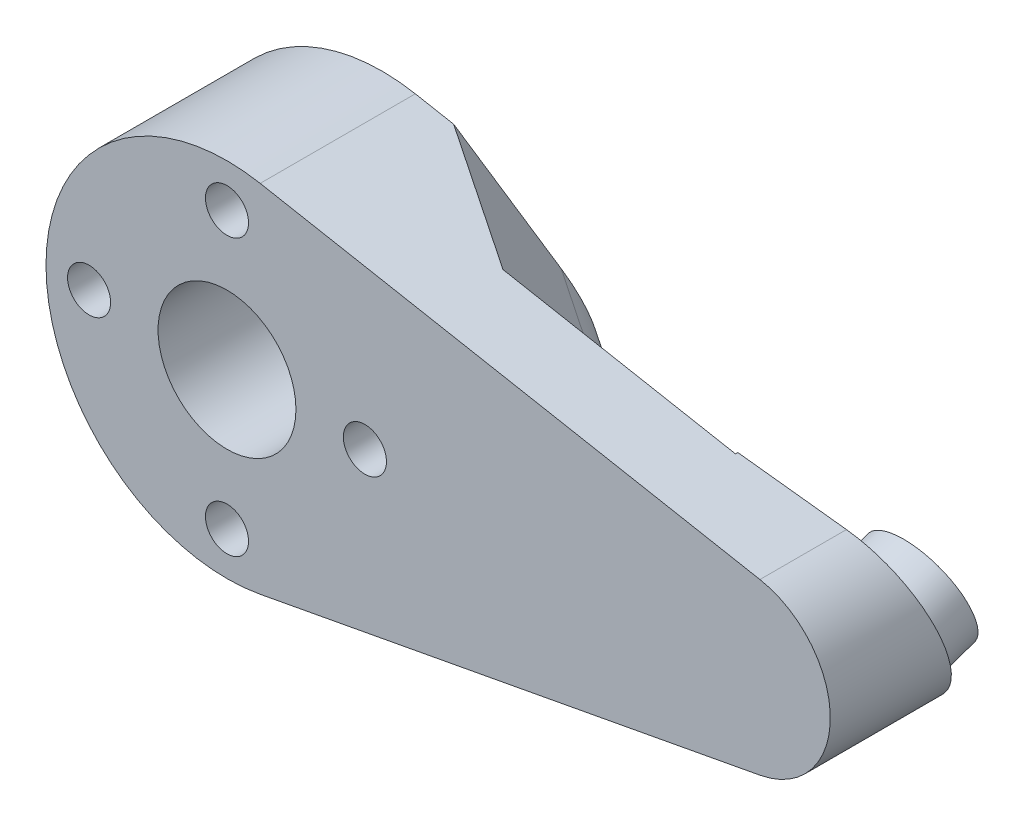
from build123d import *
from OCP.BRepFilletAPI import BRepFilletAPI_MakeChamfer

# Parameters (mm, degrees)
BOSS_EXTRU_1_DEPTH                  = 10
ENL_V_MAT_EXTRU_1_REACH             = 39.885
ESQUISSE2_R                         = 4
ESQUISSE2_R_2                       = 1.25
ENL_V_MAT_EXTRU_2_REACH             = 39.885
ENL_V_MAT_EXTRU_2_DIRECTION_2_REACH = 39.885
BOSS_EXTRU_2_START                  = 2
BOSS_EXTRU_2_DEPTH                  = 2
ENL_V_MAT_EXTRU_3_REACH             = 40.347
ESQUISSE7_R                         = 1.25
ENL_V_MAT_EXTRU_4_DEPTH             = 6
ESQUISSE8_W                         = 13.848155074
ESQUISSE8_H                         = 21.741024256
ENL_V_MAT_EXTRU_5_DEPTH             = 3
BOSS_EXTRU_3_START                  = 3
ESQUISSE9_R                         = 3.118724251
ESQUISSE9_R_2                       = 1.25
BOSS_EXTRU_3_DEPTH                  = 3
CHANFREIN1_SIZE                     = 4
CHANFREIN1_SIZE2                    = 4.445329843
CONG_1_R                            = 4
ESQUISSE10_R                        = 15.631768201
ENL_V_MAT_EXTRU_6_DEPTH             = 1


with BuildPart() as part:
    # Esquisse1 → Boss.-Extru.1 (new body)
    with BuildSketch(Plane.XY):
        with BuildLine():
            Line((1.925, 10.322033472), (30.916666667, 4.915254034))
            ThreePointArc((30.916666667, 4.915254034), (35, 0), (30.916666667, -4.915254034))
            Line((30.916666667, -4.915254034), (1.925, -10.322033472))
            ThreePointArc((1.925, -10.322033472), (-10.5, 0), (1.925, 10.322033472))
        make_face()
    extrude(amount=BOSS_EXTRU_1_DEPTH)

    # Esquisse2 → Enlèv. mat.-Extru.1 (cut, up to next)
    with BuildSketch(Plane.XY.offset(10), mode=Mode.PRIVATE) as enl_v_mat_extru_1_sk1:
        Circle(ESQUISSE2_R)
    enl_v_mat_extru_1_tool1 = extrude(enl_v_mat_extru_1_sk1.sketch, amount=-ENL_V_MAT_EXTRU_1_REACH, mode=Mode.PRIVATE) & part.part
    # Esquisse2 → Enlèv. mat.-Extru.1 (cut, up to next)
    with BuildSketch(Plane.XY.offset(10), mode=Mode.PRIVATE) as enl_v_mat_extru_1_sk2:
        with Locations((0, 8)):
            Circle(ESQUISSE2_R_2)
    enl_v_mat_extru_1_tool2 = extrude(enl_v_mat_extru_1_sk2.sketch, amount=-ENL_V_MAT_EXTRU_1_REACH, mode=Mode.PRIVATE) & part.part
    # Esquisse2 → Enlèv. mat.-Extru.1 (cut, up to next)
    with BuildSketch(Plane.XY.offset(10), mode=Mode.PRIVATE) as enl_v_mat_extru_1_sk3:
        with Locations((8, 0)):
            Circle(ESQUISSE2_R_2)
    enl_v_mat_extru_1_tool3 = extrude(enl_v_mat_extru_1_sk3.sketch, amount=-ENL_V_MAT_EXTRU_1_REACH, mode=Mode.PRIVATE) & part.part
    # Esquisse2 → Enlèv. mat.-Extru.1 (cut, up to next)
    with BuildSketch(Plane.XY.offset(10), mode=Mode.PRIVATE) as enl_v_mat_extru_1_sk4:
        with Locations((0, -8)):
            Circle(ESQUISSE2_R_2)
    enl_v_mat_extru_1_tool4 = extrude(enl_v_mat_extru_1_sk4.sketch, amount=-ENL_V_MAT_EXTRU_1_REACH, mode=Mode.PRIVATE) & part.part
    # Esquisse2 → Enlèv. mat.-Extru.1 (cut, up to next)
    with BuildSketch(Plane.XY.offset(10), mode=Mode.PRIVATE) as enl_v_mat_extru_1_sk5:
        with Locations((-8, 0)):
            Circle(ESQUISSE2_R_2)
    enl_v_mat_extru_1_tool5 = extrude(enl_v_mat_extru_1_sk5.sketch, amount=-ENL_V_MAT_EXTRU_1_REACH, mode=Mode.PRIVATE) & part.part
    add(enl_v_mat_extru_1_tool1.solids().sort_by_distance((0, 0, 10))[0], mode=Mode.SUBTRACT)
    add(enl_v_mat_extru_1_tool2.solids().sort_by_distance((0, 8, 10))[0], mode=Mode.SUBTRACT)
    add(enl_v_mat_extru_1_tool3.solids().sort_by_distance((8, 0, 10))[0], mode=Mode.SUBTRACT)
    add(enl_v_mat_extru_1_tool4.solids().sort_by_distance((0, -8, 10))[0], mode=Mode.SUBTRACT)
    add(enl_v_mat_extru_1_tool5.solids().sort_by_distance((-8, 0, 10))[0], mode=Mode.SUBTRACT)

    # Enlèv. mat.-Extru.2: up to this plane
    enl_v_mat_extru_2_end = Plane(origin=(30.916666667, -4.915254034, 10), z_dir=(-0.18333333333333338, 0.9830508068705753, 0))
    # Esquisse4 → Enlèv. mat.-Extru.2 (cut, up to the surface)
    with BuildSketch(Plane(origin=(0, 0, 0), x_dir=(1, 0, 0), z_dir=(0, 1, 0)), mode=Mode.PRIVATE) as enl_v_mat_extru_2_sk1:
        Polygon((20, -5.5), (25, -5.5), (25, 0), (11, 0), align=None)
    enl_v_mat_extru_2_tool1 = split(extrude(enl_v_mat_extru_2_sk1.sketch, amount=-ENL_V_MAT_EXTRU_2_REACH, mode=Mode.PRIVATE), bisect_by=enl_v_mat_extru_2_end, keep=Keep.BOTH, mode=Mode.PRIVATE)
    add(enl_v_mat_extru_2_tool1.solids().sort_by_distance((19.894737, 0, 2.315789))[0], mode=Mode.SUBTRACT)

    # Enlèv. mat.-Extru.2 direction 2: up to this plane
    enl_v_mat_extru_2_direction_2_end = Plane(origin=(1.925, 10.322033472, 10), z_dir=(-0.18333333333333338, -0.9830508068705753, 0))
    # Esquisse4 → Enlèv. mat.-Extru.2 direction 2 (cut, up to the surface)
    with BuildSketch(Plane(origin=(0, 0, 0), x_dir=(1, 0, 0), z_dir=(0, 1, 0)), mode=Mode.PRIVATE) as enl_v_mat_extru_2_direction_2_sk1:
        Polygon((20, -5.5), (25, -5.5), (25, 0), (11, 0), align=None)
    enl_v_mat_extru_2_direction_2_tool1 = split(extrude(enl_v_mat_extru_2_direction_2_sk1.sketch, amount=ENL_V_MAT_EXTRU_2_DIRECTION_2_REACH, mode=Mode.PRIVATE), bisect_by=enl_v_mat_extru_2_direction_2_end, keep=Keep.BOTH, mode=Mode.PRIVATE)
    add(enl_v_mat_extru_2_direction_2_tool1.solids().sort_by_distance((19.894737, 0, 2.315789))[0], mode=Mode.SUBTRACT)

    # Esquisse5 → Boss.-Extru.2 (add)
    with BuildSketch(Plane(origin=(0, 0, 0), x_dir=(-1, 0, 0), z_dir=(0, 0, -1)).offset(BOSS_EXTRU_2_START)):
        with BuildLine():
            Line((-25, -6.018678409), (-25, 6.018678409))
            Line((-25, 6.018678409), (-30.916666667, 4.915254034))
            ThreePointArc((-30.916666667, 4.915254034), (-35, 0), (-30.916666667, -4.915254034))
            Line((-30.916666667, -4.915254034), (-25, -6.018678409))
        make_face()
    extrude(amount=-BOSS_EXTRU_2_DEPTH)

    # Esquisse6 → Enlèv. mat.-Extru.3 (cut, up to next)
    with BuildSketch(Plane.ZY.offset(-25), mode=Mode.PRIVATE) as enl_v_mat_extru_3_sk1:
        Polygon((-2, -6.018678409), (2.18714034, 6.018678409), (-2, 6.018678409), align=None)
    enl_v_mat_extru_3_tool1 = extrude(enl_v_mat_extru_3_sk1.sketch, amount=-ENL_V_MAT_EXTRU_3_REACH, mode=Mode.PRIVATE) & part.part
    add(enl_v_mat_extru_3_tool1.solids().sort_by_distance((25, 2.006226, -0.604287))[0], mode=Mode.SUBTRACT)

    # Esquisse7 → Enlèv. mat.-Extru.4 (cut)
    with BuildSketch(Plane(origin=(0, -0.029034847, 0.083470529), x_dir=(-1, 0, 0), z_dir=(0, 0.32853697716879604, -0.9444911088161656))):
        with Locations(Location((-30, -1.131912, 0), (0, 0, 90))):
            Circle(ESQUISSE7_R)
    extrude(amount=-ENL_V_MAT_EXTRU_4_DEPTH, mode=Mode.SUBTRACT)

    # Esquisse8 → Enlèv. mat.-Extru.5 (cut)
    with BuildSketch(Plane(origin=(0, -0.029034847, 0.083470529), x_dir=(-1, 0, 0), z_dir=(0, 0.32853697716879604, -0.9444911088161656))):
        with Locations((-31.924077537, 0.043327094)):
            Rectangle(ESQUISSE8_W, ESQUISSE8_H)
    extrude(amount=-ENL_V_MAT_EXTRU_5_DEPTH, mode=Mode.SUBTRACT)

    # Esquisse9 → Boss.-Extru.3 (add)
    with BuildSketch(Plane(origin=(0, -1.014645779, 2.916943855), x_dir=(-1, 0, 0), z_dir=(0, 0.328536977168796, -0.9444911088161656)).offset(BOSS_EXTRU_3_START)):
        with Locations(Location((-30, -1.131912, 0), (0, 0, 258.83035879))):
            Circle(ESQUISSE9_R)
        with Locations(Location((-30, -1.131912, 0), (0, 0, 90))):
            Circle(ESQUISSE9_R_2, mode=Mode.SUBTRACT)
    extrude(amount=-BOSS_EXTRU_3_DEPTH)

    # Chanfrein1: one chamfer whose edges measure the first distance from different faces: ONE call of the kernel's chamfer builder (chamfer() names one face for all edges)
    chanfrein1_edges_1 = [part.edges().sort_by_distance(p)[0] for p in [
        (15.5, 7.790373885, 2.75),
    ]]
    chanfrein1_side_1 = [part.faces().sort_by_distance(p)[0] for p in [
        (15.338411317, 0, 2.65125136),
    ]]
    chanfrein1_edges_2 = [part.edges().sort_by_distance(p)[0] for p in [
        (15.5, -7.790373885, 2.75),
    ]]
    chanfrein1_side_2 = [part.faces().sort_by_distance(p)[0] for p in [
        (15.218457671, -7.842879913, 5.762953271),
    ]]
    chanfrein1 = BRepFilletAPI_MakeChamfer(part.part.solid().wrapped)
    for e in chanfrein1_edges_1:
        chanfrein1.Add(CHANFREIN1_SIZE, CHANFREIN1_SIZE2, e.wrapped, chanfrein1_side_1[0].wrapped)  # the first distance lies on this face
    for e in chanfrein1_edges_2:
        chanfrein1.Add(CHANFREIN1_SIZE, CHANFREIN1_SIZE2, e.wrapped, chanfrein1_side_2[0].wrapped)  # the first distance lies on this face
    add(Compound.cast(chanfrein1.Shape()), mode=Mode.REPLACE)

    # Congé1
    cong_1_edges = [part.edges().sort_by_distance(p)[0] for p in [
        (15.5, -3.289111279, 2.75),
        (15.5, 3.740044425, 2.75),
        (25, -6.018678409, 3.338156824),
    ]]
    fillet(cong_1_edges, radius=CONG_1_R)

    # Esquisse10 → Enlèv. mat.-Extru.6 (cut)
    with BuildSketch(Plane(origin=(0, 0, 0), x_dir=(-1, 0, 0), z_dir=(0, 0, -1))):
        Circle(ESQUISSE10_R)
    extrude(amount=-ENL_V_MAT_EXTRU_6_DEPTH, mode=Mode.SUBTRACT)


solid = part.part
